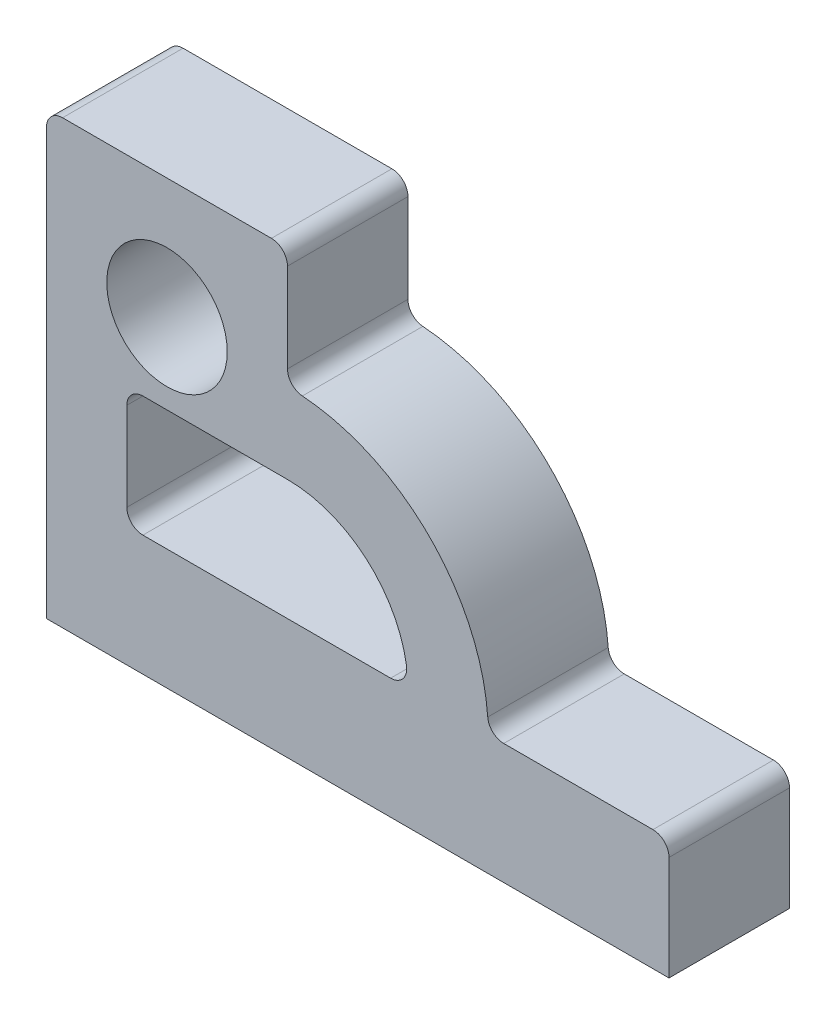
from build123d import *

# Parameters (mm, degrees)
SKETCH1_R           = 15
BOSS_EXTRUDE1_DEPTH = 15


with BuildPart() as part:
    # Sketch1 → Boss-Extrude1 (new, symmetric)
    with BuildSketch(Plane.XY):
        with BuildLine():
            Line((0, 0), (0, 106))
            ThreePointArc((0, 106), (1.171572875, 108.828427125), (4, 110))
            Line((4, 110), (56, 110))
            ThreePointArc((56, 110), (58.828427125, 108.828427125), (60, 106))
            Line((60, 106), (60, 83.851648071))
            ThreePointArc((60, 83.851648071), (61.068687565, 81.129992802), (63.703703704, 79.862637103))
            ThreePointArc((63.703703704, 79.862637103), (95.355339059, 65.355339059), (109.862637103, 33.703703704))
            ThreePointArc((109.862637103, 33.703703704), (111.129992802, 31.068687565), (113.851648071, 30))
            Line((113.851648071, 30), (151, 30))
            ThreePointArc((151, 30), (153.828427125, 28.828427125), (155, 26))
            Line((155, 26), (155, 0))
            Line((155, 0), (0, 0))
        make_face()
        with Locations((30, 80)):
            Circle(SKETCH1_R, mode=Mode.SUBTRACT)
        with BuildLine():
            Line((85.690465157, 30), (24, 30))
            ThreePointArc((24, 30), (21.171572875, 31.171572875), (20, 34))
            Line((20, 34), (20, 56))
            ThreePointArc((20, 56), (21.171572875, 58.828427125), (24, 60))
            Line((24, 60), (60, 60))
            ThreePointArc((60, 60), (79.513309068, 52.786635759), (89.642844412, 34.615384615))
            ThreePointArc((89.642844412, 34.615384615), (88.728683259, 31.398225458), (85.690465157, 30))
        make_face(mode=Mode.SUBTRACT)
    extrude(amount=BOSS_EXTRUDE1_DEPTH, both=True)


solid = part.part
